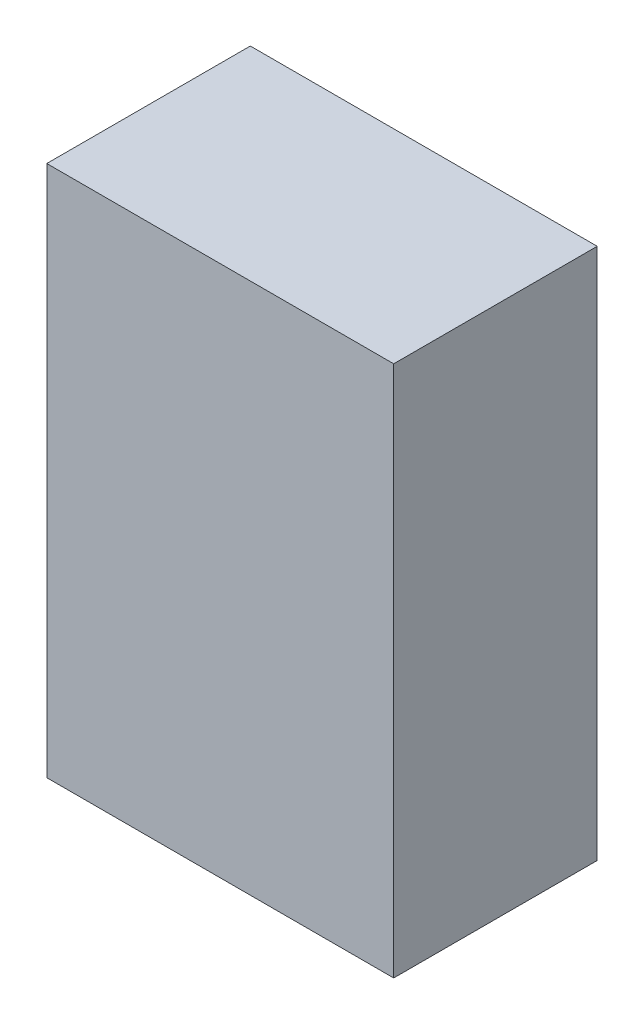
from build123d import *

# Parameters (mm, degrees)
SKETCH_1_W      = 30
SKETCH_1_H      = 17.6
EXTRUDE_1_DEPTH = 46


with BuildPart() as part:
    # 草图1 → 凸台-拉伸1 (new body)
    with BuildSketch(Plane(origin=(0, 0, 0), x_dir=(1, 0, 0), z_dir=(0, 1, 0))):
        Rectangle(SKETCH_1_W, SKETCH_1_H)
    extrude(amount=EXTRUDE_1_DEPTH)


solid = part.part
